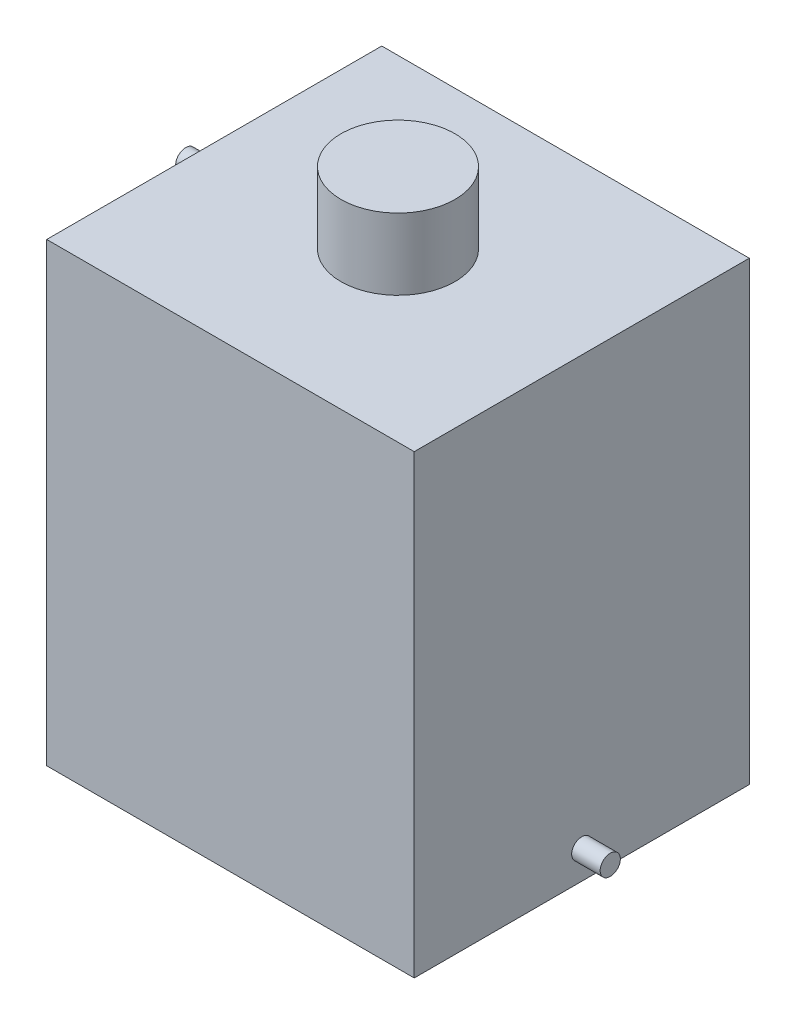
from build123d import *

# Parameters (mm, degrees)
SKETCH1_W           = 163.83
SKETCH1_H           = 149.352
BOSS_EXTRUDE1_DEPTH = 203.2
SKETCH2_R           = 25.4
BOSS_EXTRUDE2_DEPTH = 31.75
SKETCH3_R           = 4.5
BOSS_EXTRUDE3_DEPTH = 12.7
SKETCH5_R           = 4.5
BOSS_EXTRUDE4_DEPTH = 12.7


with BuildPart() as part:
    # Sketch1 → Boss-Extrude1 (new body)
    with BuildSketch(Plane(origin=(0, 0, 0), x_dir=(1, 0, 0), z_dir=(0, 1, 0))):
        Rectangle(SKETCH1_W, SKETCH1_H)
    extrude(amount=BOSS_EXTRUDE1_DEPTH)

    # Sketch2 → Boss-Extrude2 (add)
    with BuildSketch(Plane(origin=(0, 203.2, 0), x_dir=(1, 0, 0), z_dir=(0, 1, 0))):
        with Locations(Location((0, 0, 0), (0, 0, 270))):
            Circle(SKETCH2_R)
    extrude(amount=BOSS_EXTRUDE2_DEPTH)

    # Sketch3 → Boss-Extrude3 (add)
    with BuildSketch(Plane.ZY.offset(81.915)):
        with Locations(Location((0, 190.5, 0), (0, 0, 180))):
            Circle(SKETCH3_R)
    extrude(amount=BOSS_EXTRUDE3_DEPTH)

    # Sketch5 → Boss-Extrude4 (add)
    with BuildSketch(Plane(origin=(81.915, 0, 0), x_dir=(0, 0, -1), z_dir=(1, 0, 0))):
        with Locations(Location((0, 12.7, 0), (0, 0, 180))):
            Circle(SKETCH5_R)
    extrude(amount=BOSS_EXTRUDE4_DEPTH)


solid = part.part
